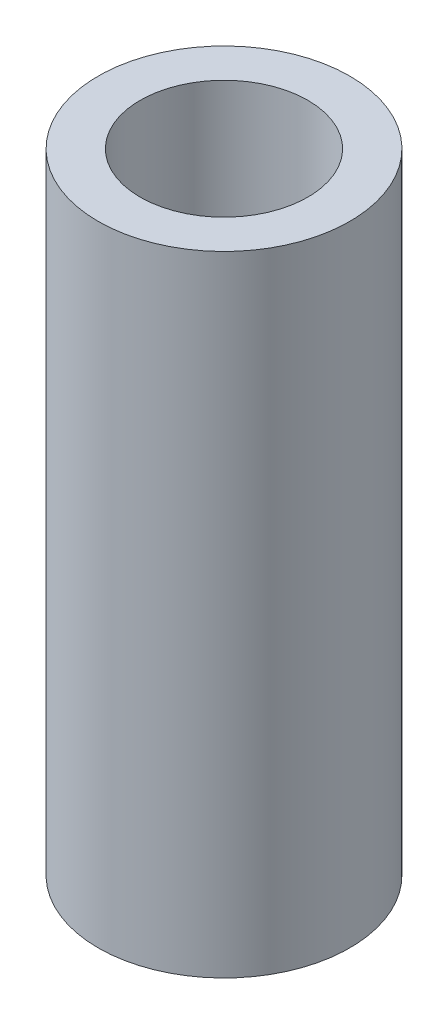
from build123d import *

# Parameters (mm, degrees)
SKETCH1_R           = 3
BOSS_EXTRUDE1_DEPTH = 15
SKETCH2_R           = 2
CUT_EXTRUDE1_DEPTH  = 16.588457268


with BuildPart() as part:
    # Sketch1 → Boss-Extrude1 (new body)
    with BuildSketch(Plane(origin=(0, 0, 0), x_dir=(1, 0, 0), z_dir=(0, 1, 0))):
        with Locations(Location((0, 0, 0), (0, 0, 270))):
            Circle(SKETCH1_R)
    extrude(amount=BOSS_EXTRUDE1_DEPTH)

    # Sketch2 → Cut-Extrude1 (cut, through all)
    with BuildSketch(Plane(origin=(0, 15, 0), x_dir=(1, 0, 0), z_dir=(0, 1, 0))):
        with Locations(Location((0, 0, 0), (0, 0, 270))):
            Circle(SKETCH2_R)
    extrude(amount=-CUT_EXTRUDE1_DEPTH, mode=Mode.SUBTRACT)


solid = part.part
